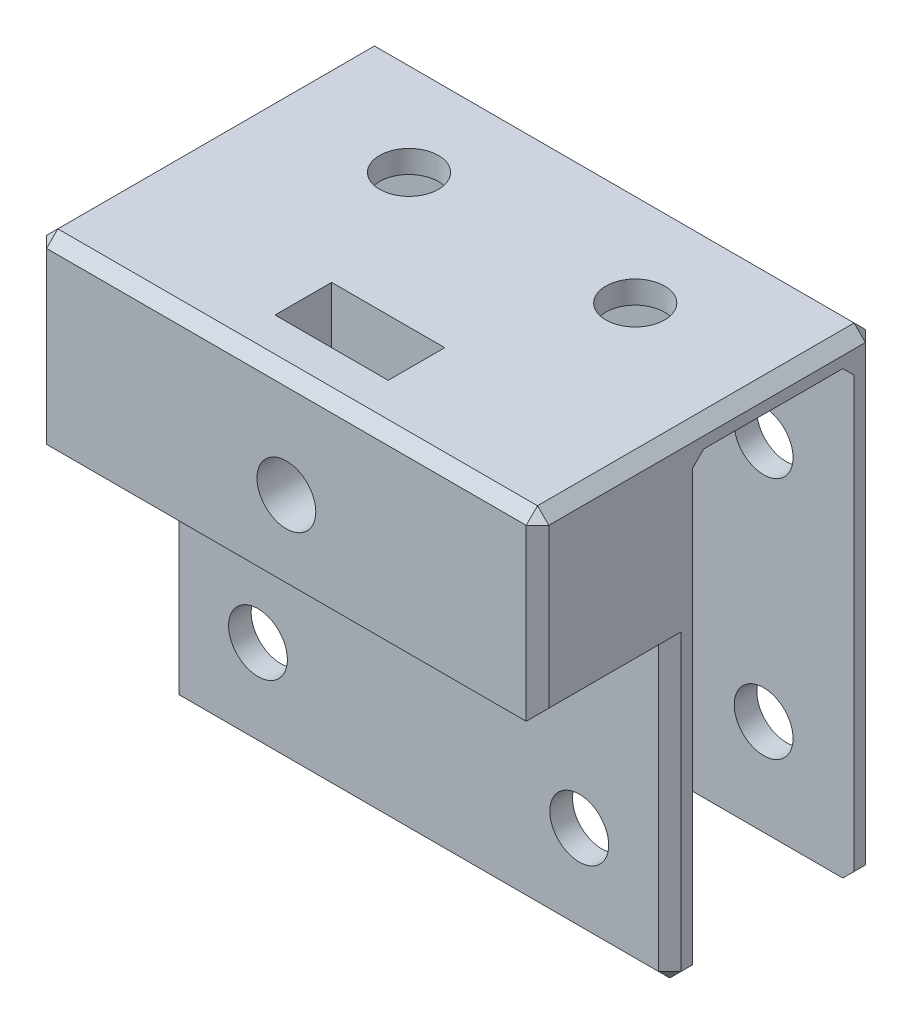
from build123d import *

# Parameters (mm, degrees)
SKETCH1_W           = 44.4
SKETCH1_H           = 40
SKETCH1_R           = 2.6
BOSS_EXTRUDE1_DEPTH = 2
SKETCH2_W           = 44.4
SKETCH2_H           = 18.3
BOSS_EXTRUDE2_DEPTH = 2
LPATTERN1_COUNT     = 2
LPATTERN1_PITCH     = 16.3
SKETCH3_R           = 2.6
CUT_EXTRUDE1_DEPTH  = 64.253853638
BOSS_EXTRUDE3_START = -22.2
SKETCH6_W           = 11.69
SKETCH6_H           = 16
BOSS_EXTRUDE3_DEPTH = 44.4
FILLET4_SIZE        = 1
SKETCH11_W          = 10
SKETCH11_H          = 5
CUT_EXTRUDE6_DEPTH  = 14
SKETCH12_W          = 10
SKETCH12_H          = 8.384441544
CUT_EXTRUDE7_DEPTH  = 11
SKETCH7_R           = 2.6
CUT_EXTRUDE2_DEPTH  = 9


with BuildPart() as part:
    # Sketch1 → Boss-Extrude1 (new body)
    with BuildSketch(Plane.XY):
        with Locations((22.2, 20)):
            Rectangle(SKETCH1_W, SKETCH1_H)
        with Locations((8, 8.476902454)):
            Circle(SKETCH1_R, mode=Mode.SUBTRACT)
        with Locations((8, 29.976902454)):
            Circle(SKETCH1_R, mode=Mode.SUBTRACT)
        with Locations((36.4, 29.976902454)):
            Circle(SKETCH1_R, mode=Mode.SUBTRACT)
        with Locations((36.4, 8.476902454)):
            Circle(SKETCH1_R, mode=Mode.SUBTRACT)
    boss_extrude1 = extrude(amount=BOSS_EXTRUDE1_DEPTH)

    # Sketch2 → Boss-Extrude2 (add)
    with BuildSketch(Plane(origin=(0, 40, 0), x_dir=(1, 0, 0), z_dir=(0, 1, 0))):
        with Locations((22.2, 7.15)):
            Rectangle(SKETCH2_W, SKETCH2_H)
    extrude(amount=BOSS_EXTRUDE2_DEPTH)

    # LPattern1: Boss-Extrude1 ×2
    with Locations(*[(0, 0, -i * LPATTERN1_PITCH) for i in range(1, LPATTERN1_COUNT)]):
        add(boss_extrude1)

    # Sketch3 → Cut-Extrude1 (cut, through all)
    with BuildSketch(Plane(origin=(0, 42, 0), x_dir=(1, 0, 0), z_dir=(0, 1, 0))):
        with Locations(Location((12.2, 7.15, 0), (0, 0, 270))):
            Circle(SKETCH3_R)
        with Locations(Location((32.2, 7.15, 0), (0, 0, 270))):
            Circle(SKETCH3_R)
    extrude(amount=-CUT_EXTRUDE1_DEPTH, mode=Mode.SUBTRACT)

    # Sketch6 → Boss-Extrude3 (add)
    with BuildSketch(Plane(origin=(22.2, 0, 0), x_dir=(0, 0, -1), z_dir=(1, 0, 0)).offset(BOSS_EXTRUDE3_START)):
        with Locations((-7.845, 34)):
            Rectangle(SKETCH6_W, SKETCH6_H)
    extrude(amount=BOSS_EXTRUDE3_DEPTH)

    # Fillet4
    fillet4_edges = [part.edges().sort_by_distance(p)[0] for p in [
        (44.4, 13, 2),
        (0, 21, -16.3),
        (44.4, 21, -16.3),
        (0, 42, -1.305),
        (44.4, 42, -1.305),
        (22.2, 42, -16.3),
        (22.2, 40, -14.3),
        (22.2, 0, -16.3),
        (0, 0, -15.3),
        (44.4, 0, -15.3),
        (22.2, 40, 0),
        (0, 13, 2),
        (44.4, 26, 7.845),
        (44.4, 34, 13.69),
        (22.2, 42, 13.69),
        (0, 26, 7.845),
        (0, 34, 13.69),
        (44.4, 0, 1),
        (0, 0, 1),
        (22.2, 0, 2),
    ]]
    chamfer(fillet4_edges, length=FILLET4_SIZE)

    # Sketch11 → Cut-Extrude6 (cut)
    with BuildSketch(Plane(origin=(0, 42, 0), x_dir=(1, 0, 0), z_dir=(0, 1, 0))):
        with Locations((22.2, -7.19)):
            Rectangle(SKETCH11_W, SKETCH11_H)
    extrude(amount=-CUT_EXTRUDE6_DEPTH, mode=Mode.SUBTRACT)

    # Sketch12 → Cut-Extrude7 (cut)
    with BuildSketch(Plane.XZ.offset(-26)):
        with Locations((8, 6.192220772)):
            Rectangle(SKETCH12_W, SKETCH12_H)
        with Locations((36.4, 6.192220772)):
            Rectangle(SKETCH12_W, SKETCH12_H)
    extrude(amount=-CUT_EXTRUDE7_DEPTH, mode=Mode.SUBTRACT)

    # Sketch7 → Cut-Extrude2 (cut)
    with BuildSketch(Plane.XY.offset(13.69)):
        with Locations((22.2, 32.73)):
            Circle(SKETCH7_R)
    extrude(amount=-CUT_EXTRUDE2_DEPTH, mode=Mode.SUBTRACT)


solid = part.part
